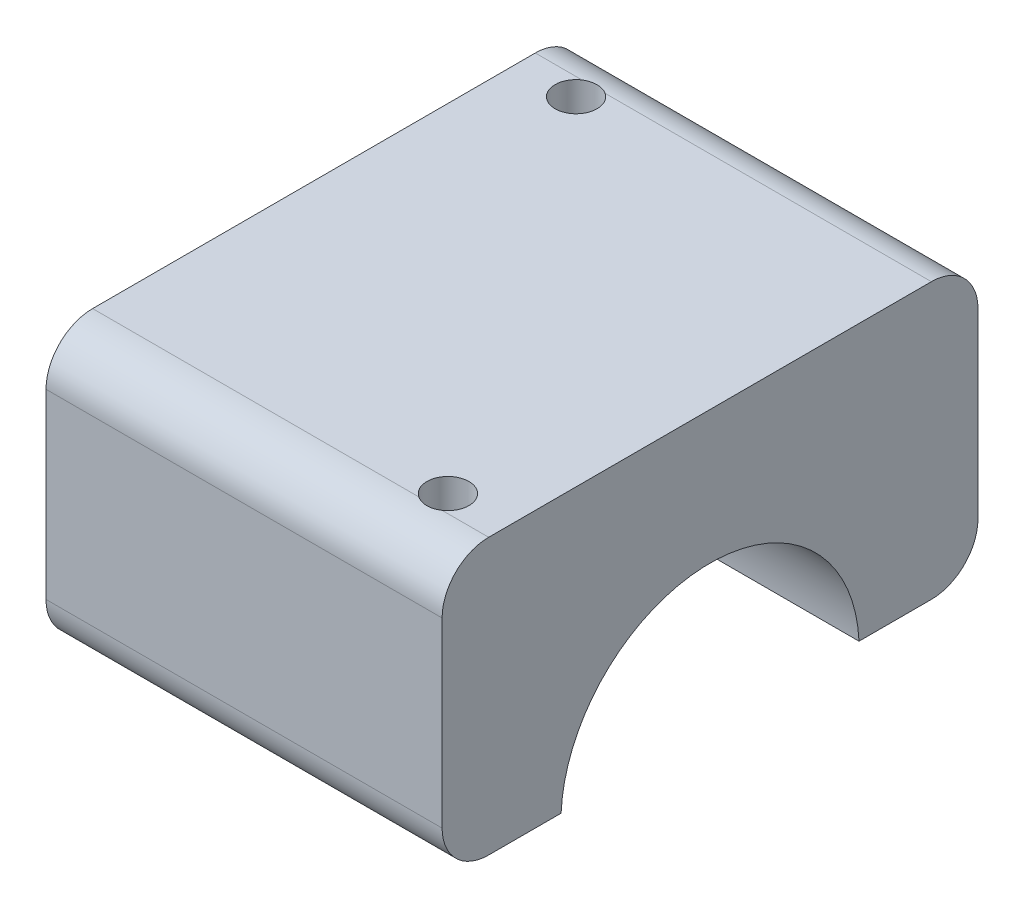
from build123d import *

# Parameters (mm, degrees)
BOSS_EXTRUDE1_DEPTH     = 17
CUT_EXTRUDE1_DEPTH      = 38.47875186
CUT_EXTRUDE1_DEPTH_BACK = 38.47875186
SKETCH2_R               = 12.8
SKETCH3_R               = 1.8
CUT_EXTRUDE2_DEPTH      = 24.221


with BuildPart() as part:
    # Sketch1 → Boss-Extrude1 (new, symmetric)
    with BuildSketch(Plane(origin=(0, 0, 0), x_dir=(0, 0, -1), z_dir=(1, 0, 0))):
        with BuildLine():
            Line((-19, 0.6), (19, 0.6))
            ThreePointArc((19, 0.6), (21.828427125, 1.771572875), (23, 4.6))
            Line((23, 4.6), (23, 20.221))
            ThreePointArc((23, 20.221), (21.828427125, 23.049427125), (19, 24.221))
            Line((19, 24.221), (-19, 24.221))
            ThreePointArc((-19, 24.221), (-21.828427125, 23.049427125), (-23, 20.221))
            Line((-23, 20.221), (-23, 4.6))
            ThreePointArc((-23, 4.6), (-21.828427125, 1.771572875), (-19, 0.6))
        make_face()
    extrude(amount=BOSS_EXTRUDE1_DEPTH, both=True)

    # Sketch2 → Cut-Extrude1 (cut, two sides: drawn at the far end of the back side and taken through both)
    with BuildSketch(Plane(origin=(0, 0, 0), x_dir=(0, 0, -1), z_dir=(1, 0, 0)).offset(-CUT_EXTRUDE1_DEPTH_BACK)):
        Circle(SKETCH2_R)
    extrude(amount=CUT_EXTRUDE1_DEPTH + CUT_EXTRUDE1_DEPTH_BACK, mode=Mode.SUBTRACT)

    # Sketch3 → Cut-Extrude2 (cut)
    with BuildSketch(Plane(origin=(0, 0.6, 0), x_dir=(1, 0, 0), z_dir=(0, 1, 0))):
        with Locations(Location((12, -17.5, 0), (0, 0, 236.442690238))):
            Circle(SKETCH3_R)
        with Locations(Location((-12, 17.5, 0), (0, 0, 123.557309762))):
            Circle(SKETCH3_R)
    extrude(amount=CUT_EXTRUDE2_DEPTH, mode=Mode.SUBTRACT)


solid = part.part
